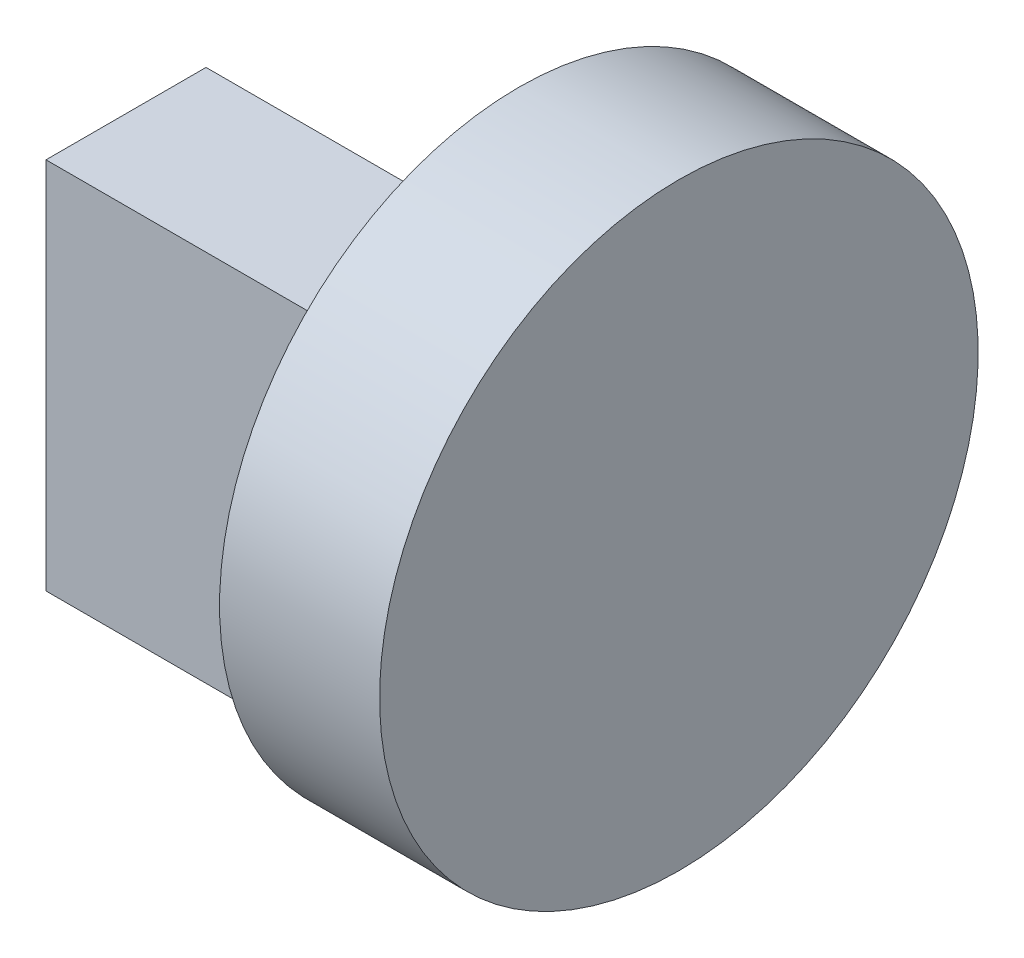
from build123d import *

# Parameters (mm, degrees)
SKETCH_1_W           = 25
SKETCH_1_H           = 35
EXTRUDE_1_DEPTH      = 15
SKETCH_3_W           = 13
SKETCH_3_H           = 12
EXTRUDE_2_DEPTH      = 5
EXTRUDE_START        = 30
SKETCH_4_R           = 4
EXTRUDE_3_DEPTH      = 2
EXTRUDE_4_DEPTH      = 4.819582841
EXTRUDE_4_DEPTH_BACK = 2
EXTRUDE_4_START      = 32
SKETCH_5_R           = 1.5
EXTRUDE_START_2      = 36.819583
SKETCH_6_R           = 28.053339705
EXTRUDE_5_DEPTH      = 15


with BuildPart() as part:
    # 草图1 → 凸台-拉伸1 (new body)
    with BuildSketch(Plane.XY):
        with Locations((12.5, -17.5)):
            Rectangle(SKETCH_1_W, SKETCH_1_H)
    extrude(amount=EXTRUDE_1_DEPTH)

    # 草图3 → 凸台-拉伸2 (add)
    with BuildSketch(Plane(origin=(25, 0, 0), x_dir=(0, 0, -1), z_dir=(1, 0, 0))):
        with Locations((-7.5, -7)):
            Rectangle(SKETCH_3_W, SKETCH_3_H)
    extrude(amount=EXTRUDE_2_DEPTH)

    # 草图4 → 凸台-拉伸3 (add)
    with BuildSketch(Plane(origin=(0, 0, 0), x_dir=(0, 0, -1), z_dir=(1, 0, 0)).offset(EXTRUDE_START)):
        with Locations(Location((-7.5, -7.5, 0), (0, 0, 90))):
            Circle(SKETCH_4_R)
    extrude(amount=EXTRUDE_3_DEPTH)

    # 草图5 → 凸台-拉伸4 (add, two sides: drawn at the far end of the back side and taken through both)
    with BuildSketch(Plane(origin=(0, 0, 0), x_dir=(0, 0, -1), z_dir=(1, 0, 0)).offset(EXTRUDE_4_START - EXTRUDE_4_DEPTH_BACK)):
        with Locations(Location((-7.5, -7.5, 0), (0, 0, 90))):
            Circle(SKETCH_5_R)
    extrude(amount=EXTRUDE_4_DEPTH + EXTRUDE_4_DEPTH_BACK)

    # 草图6 → 凸台-拉伸5 (add)
    with BuildSketch(Plane(origin=(0, 0, 0), x_dir=(0, 0, -1), z_dir=(1, 0, 0)).offset(EXTRUDE_START_2)):
        with Locations(Location((-7.5, -7.5, 0), (0, 0, 90))):
            Circle(SKETCH_6_R)
    extrude(amount=EXTRUDE_5_DEPTH)


solid = part.part
